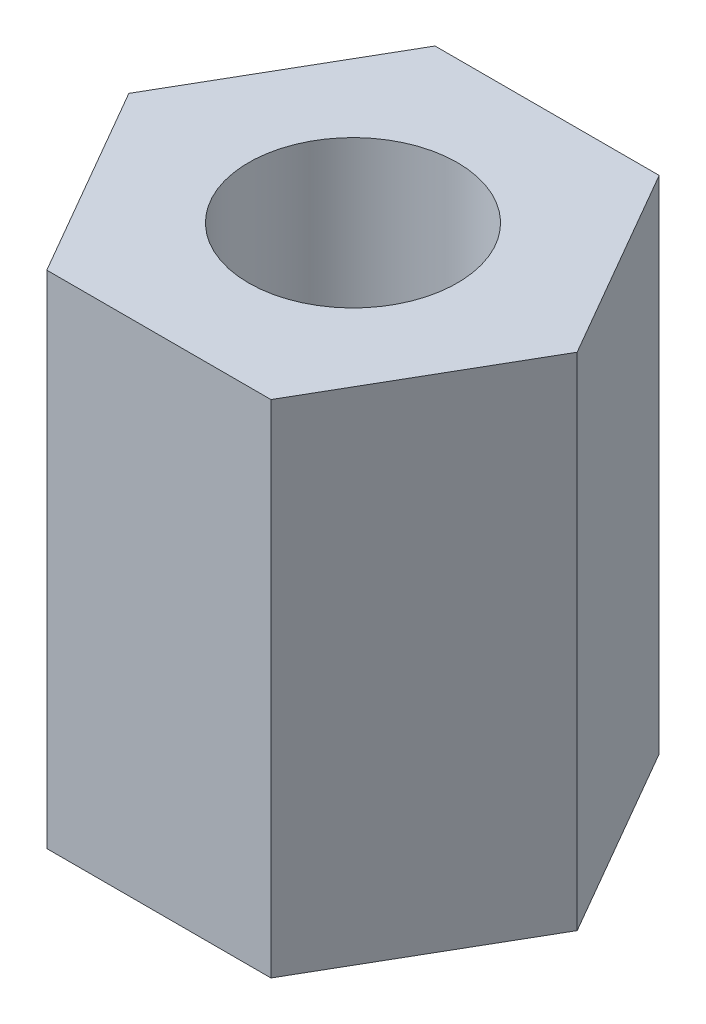
from build123d import *

# Parameters (mm, degrees)
BASE_DEPTH = 6
SKETCH2_R  = 1.25
HOLE_DEPTH = 6


with BuildPart() as part:
    # Sketch1 → base (new body)
    with BuildSketch(Plane(origin=(0, 0, 0), x_dir=(1, 0, 0), z_dir=(0, 1, 0))):
        Polygon((2.684678752, 0), (1.342339376, 2.325), (-1.342339376, 2.325), (-2.684678752, 0), (-1.342339376, -2.325), (1.342339376, -2.325), align=None)
    extrude(amount=BASE_DEPTH)

    # Sketch2 → hole (cut)
    with BuildSketch(Plane(origin=(0, 6, 0), x_dir=(1, 0, 0), z_dir=(0, 1, 0))):
        with Locations(Location((0, 0, 0), (0, 0, 270))):
            Circle(SKETCH2_R)
    extrude(amount=-HOLE_DEPTH, mode=Mode.SUBTRACT)


solid = part.part
